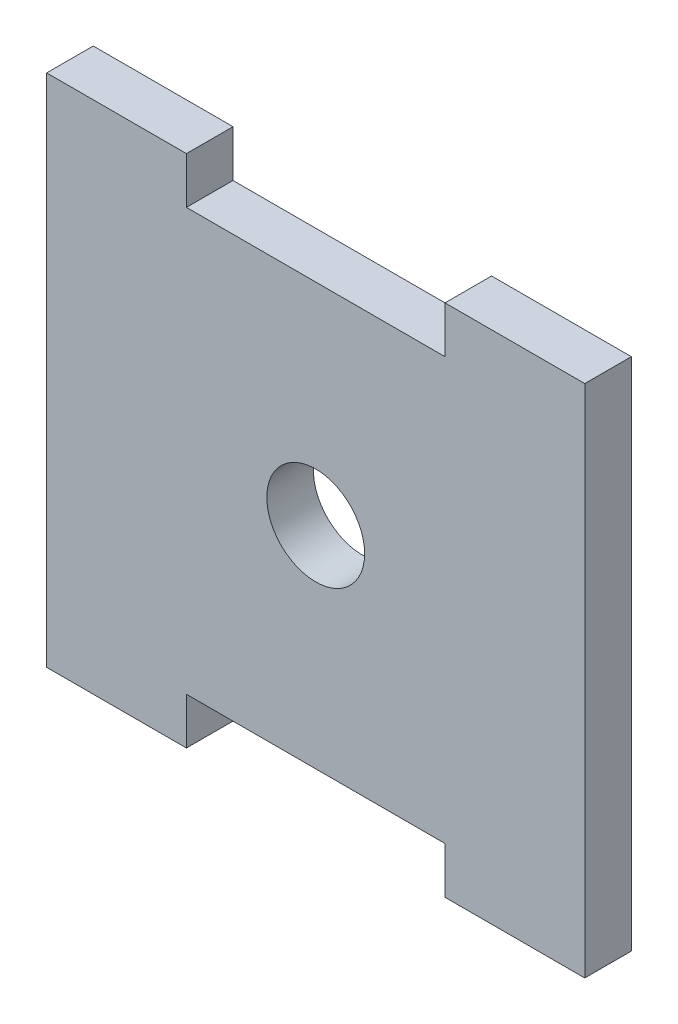
from build123d import *

# Parameters (mm, degrees)
SKETCH_1_R      = 2.1
EXTRUDE_1_DEPTH = 2


with BuildPart() as part:
    # 草图1 → 凸台-拉伸1 (new body)
    with BuildSketch(Plane.XY):
        Polygon((-3, 1), (3, 1), (3, -1), (14.1, -1), (14.1, 1), (20.1, 1), (20.1, -1), (20.1, -19.1), (20.1, -21.1), (14.1, -21.1), (14.1, -19.1), (3, -19.1), (3, -21.1), (-3, -21.1), (-3, -19.1), (-3, -1), align=None)
        with Locations((8.55, -10.05)):
            Circle(SKETCH_1_R, mode=Mode.SUBTRACT)
    extrude(amount=EXTRUDE_1_DEPTH)


solid = part.part
